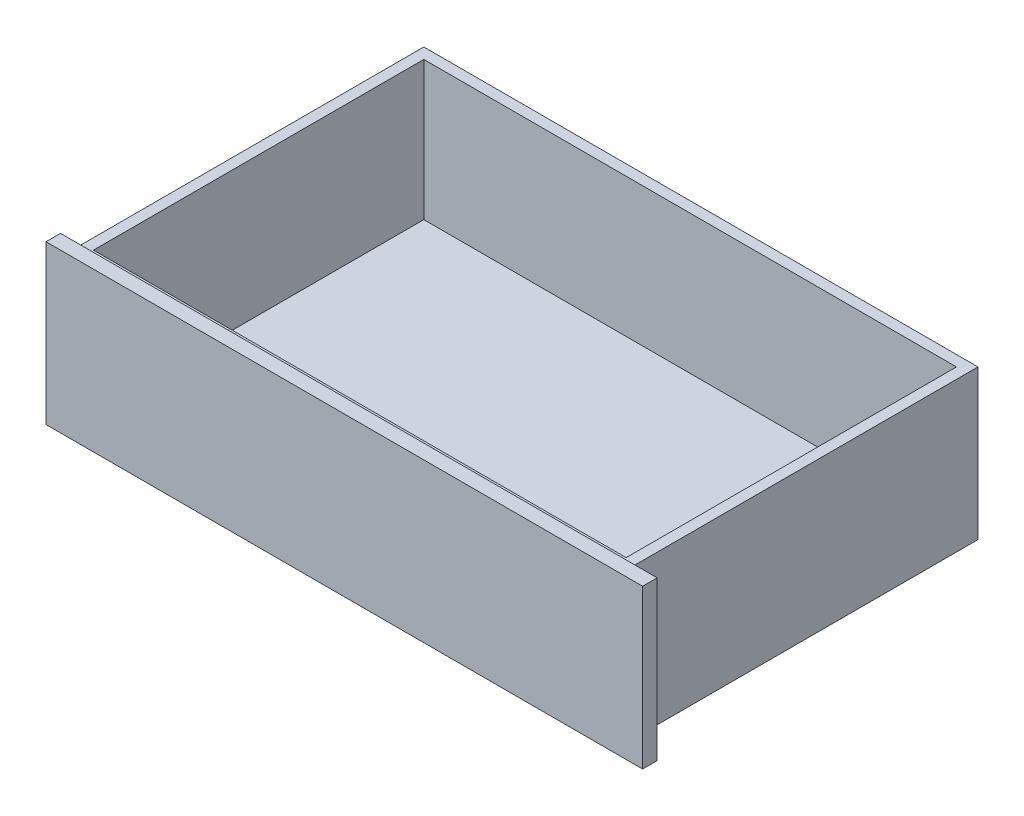
from build123d import *

# Parameters (mm, degrees)
SKETCH1_W           = 630
SKETCH1_H           = 400
EXTRUSION_DEPTH     = 170
DRAWER_S_INTERIOR_T = -12.2428
SKETCH3_W           = 678.2428
SKETCH3_H           = 180
BOSS_EXTRUDE3_DEPTH = 16.5


with BuildPart() as part:
    # Sketch1 → Extrusion (new body)
    with BuildSketch(Plane(origin=(0, 0, 0), x_dir=(1, 0, 0), z_dir=(0, 1, 0))):
        Rectangle(SKETCH1_W, SKETCH1_H)
    extrude(amount=EXTRUSION_DEPTH)

    # Drawer's interior
    drawer_s_interior_openings = [part.faces().sort_by_distance(p)[0] for p in [
        (0, 170, 0),
    ]]
    offset(amount=DRAWER_S_INTERIOR_T, openings=drawer_s_interior_openings, kind=Kind.INTERSECTION)

    # Sketch3 → Boss-Extrude3 (add)
    with BuildSketch(Plane.XY.offset(200)):
        with Locations((11.1214, 90)):
            Rectangle(SKETCH3_W, SKETCH3_H)
    extrude(amount=BOSS_EXTRUDE3_DEPTH)


solid = part.part
